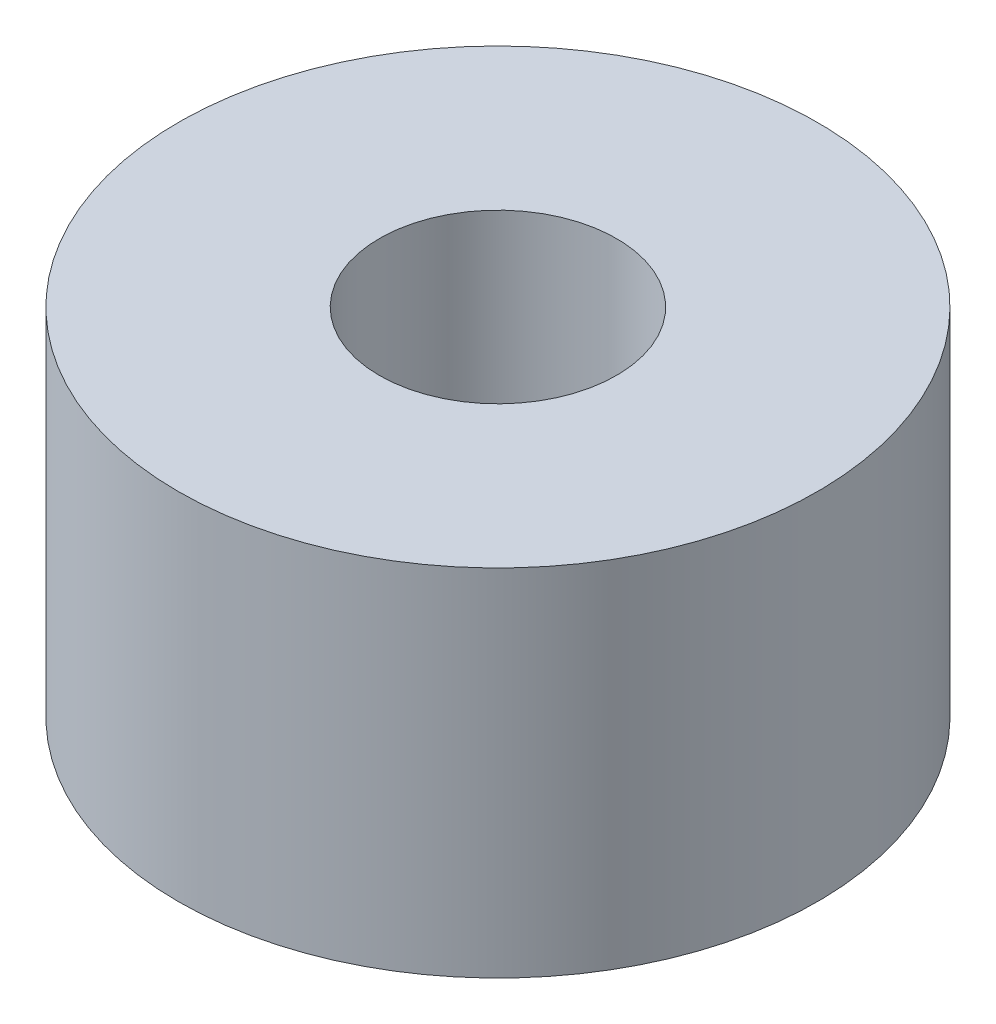
from build123d import *

# Parameters (mm, degrees)
SKETCH1_R           = 5.715
SKETCH1_R_2         = 2.1209
BOSS_EXTRUDE1_DEPTH = 6.35


with BuildPart() as part:
    # Sketch1 → Boss-Extrude1 (new body)
    with BuildSketch(Plane(origin=(0, 0, 0), x_dir=(1, 0, 0), z_dir=(0, 1, 0))):
        with Locations(Location((0, 0, 0), (0, 0, 270))):
            Circle(SKETCH1_R)
        with Locations(Location((0, 0, 0), (0, 0, 270))):
            Circle(SKETCH1_R_2, mode=Mode.SUBTRACT)
    extrude(amount=BOSS_EXTRUDE1_DEPTH)


solid = part.part
